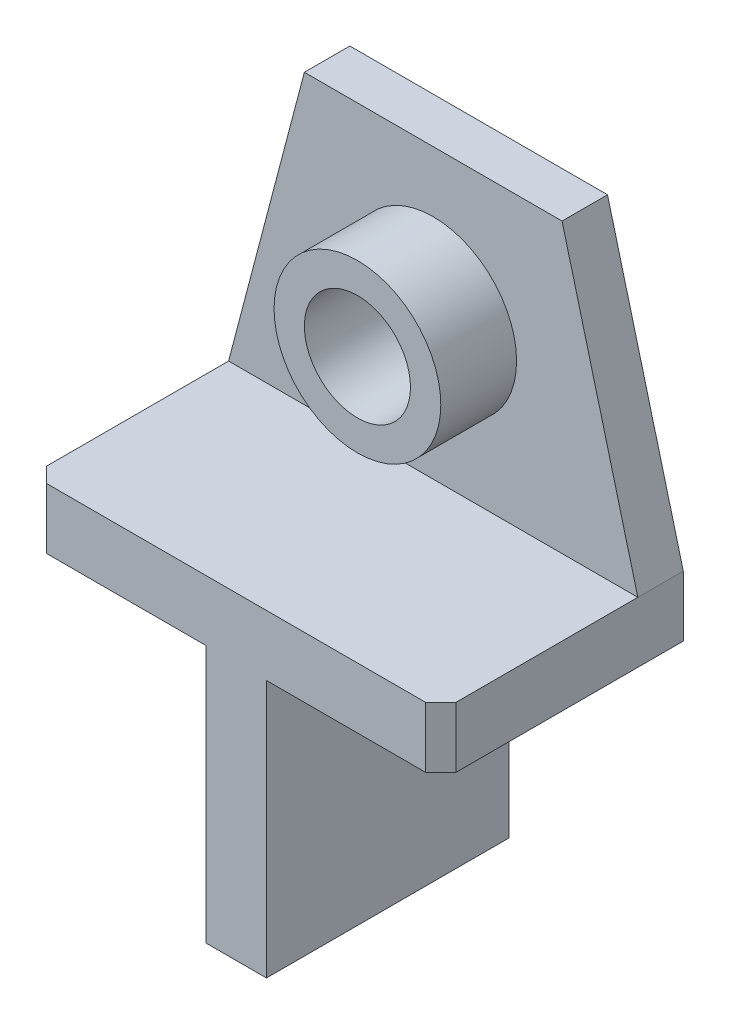
from build123d import *

# Parameters (mm, degrees)
BOSS_EXTRUDE1_DEPTH = 32
CHAMFER1_SIZE       = 2
BOSS_EXTRUDE2_DEPTH = 6
SKETCH11_R          = 11
SKETCH11_R_2        = 7
BOSS_EXTRUDE3_DEPTH = 10
CUT_EXTRUDE1_START  = -6
SKETCH14_R          = 7
CUT_EXTRUDE1_DEPTH  = 6


with BuildPart() as part:
    # Sketch1 → Boss-Extrude1 (new body)
    with BuildSketch(Plane.XY):
        Polygon((0, -1.708319116), (0, 32.291680884), (-23, 32.291680884), (-23, 40.291680884), (31, 40.291680884), (31, 32.291680884), (8, 32.291680884), (8, -1.708319116), align=None)
    extrude(amount=-BOSS_EXTRUDE1_DEPTH)

    # Chamfer1
    chamfer1_edges = [part.edges().sort_by_distance(p)[0] for p in [
        (-23, 36.291680884, 0),
        (31, 36.291680884, 0),
    ]]
    chamfer(chamfer1_edges, length=CHAMFER1_SIZE)

    # Sketch5 → Boss-Extrude2 (add)
    with BuildSketch(Plane(origin=(0, 0, -32), x_dir=(-1, 0, 0), z_dir=(0, 0, -1))):
        Polygon((23, 40.291680884), (-31, 40.291680884), (-21, 78.291680884), (13, 78.291680884), align=None)
    extrude(amount=-BOSS_EXTRUDE2_DEPTH)

    # Sketch11 → Boss-Extrude3 (add)
    with BuildSketch(Plane.XY.offset(-26)):
        with Locations((4, 59.291680884)):
            Circle(SKETCH11_R)
        with Locations((4, 59.291680884)):
            Circle(SKETCH11_R_2, mode=Mode.SUBTRACT)
    extrude(amount=BOSS_EXTRUDE3_DEPTH)

    # Sketch14 → Cut-Extrude1 (cut)
    with BuildSketch(Plane.XY.offset(-26).offset(CUT_EXTRUDE1_START)):
        with Locations((4, 59.291680884)):
            Circle(SKETCH14_R)
    extrude(amount=CUT_EXTRUDE1_DEPTH, mode=Mode.SUBTRACT)


solid = part.part
